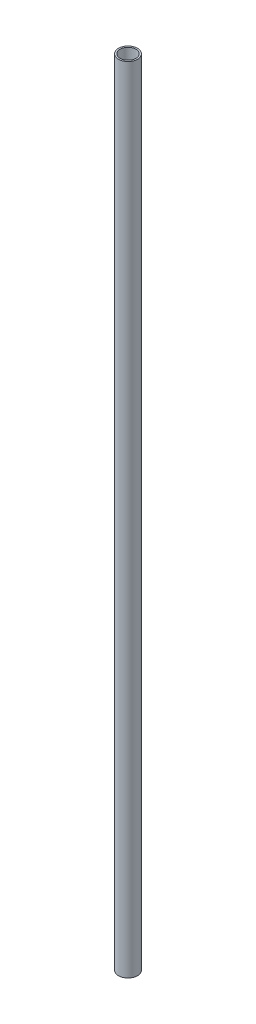
from build123d import *

# Parameters (mm, degrees)
SKETCH1_R           = 6
SKETCH1_R_2         = 5
BOSS_EXTRUDE1_DEPTH = 500


with BuildPart() as part:
    # Sketch1 → Boss-Extrude1 (new body)
    with BuildSketch(Plane(origin=(0, 0, 0), x_dir=(1, 0, 0), z_dir=(0, 1, 0))):
        with Locations(Location((0, 0, 0), (0, 0, 270))):
            Circle(SKETCH1_R)
        with Locations(Location((0, 0, 0), (0, 0, 270))):
            Circle(SKETCH1_R_2, mode=Mode.SUBTRACT)
    extrude(amount=BOSS_EXTRUDE1_DEPTH)


solid = part.part
